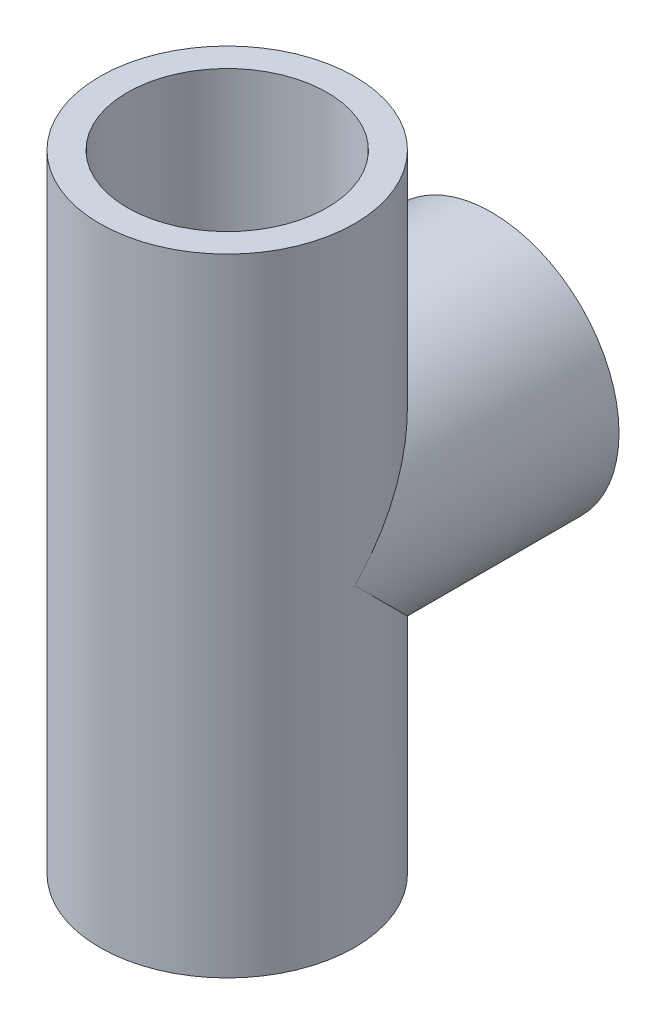
from build123d import *

# Parameters (mm, degrees)
SKETCH1_R           = 17.145
SKETCH1_R_2         = 11.43
BOSS_EXTRUDE1_DEPTH = 84.328
SKETCH2_R           = 17.145
SKETCH2_R_2         = 11.43
BOSS_EXTRUDE2_DEPTH = 35.56
SKETCH3_R           = 11.43
CUT_EXTRUDE1_DEPTH  = 94.111096186
CUT_EXTRUDE2_START  = -35.56
SKETCH4_R           = 11.43
CUT_EXTRUDE2_DEPTH  = 35.56
SKETCH5_R           = 13.4366
CUT_EXTRUDE3_DEPTH  = 20.6375
CUT_EXTRUDE4_START  = -20.6375
SKETCH6_R           = 13.4366
CUT_EXTRUDE4_DEPTH  = 20.6375
SKETCH7_R           = 13.4366
CUT_EXTRUDE5_DEPTH  = 20.6375


with BuildPart() as part:
    # Sketch1 → Boss-Extrude1 (new body)
    with BuildSketch(Plane(origin=(0, 0, 0), x_dir=(1, 0, 0), z_dir=(0, 1, 0))):
        with Locations(Location((0, 0, 0), (0, 0, 270))):
            Circle(SKETCH1_R)
        with Locations(Location((0, 0, 0), (0, 0, 270))):
            Circle(SKETCH1_R_2, mode=Mode.SUBTRACT)
    extrude(amount=BOSS_EXTRUDE1_DEPTH)

    # Sketch2 → Boss-Extrude2 (add)
    with BuildSketch(Plane.XY):
        with Locations((0, 42.164)):
            Circle(SKETCH2_R)
        with Locations((0, 42.164)):
            Circle(SKETCH2_R_2, mode=Mode.SUBTRACT)
    extrude(amount=-BOSS_EXTRUDE2_DEPTH)

    # Sketch3 → Cut-Extrude1 (cut, through all)
    with BuildSketch(Plane(origin=(0, 84.328, 0), x_dir=(1, 0, 0), z_dir=(0, 1, 0))):
        with Locations(Location((0, 0, 0), (0, 0, 270))):
            Circle(SKETCH3_R)
    extrude(amount=-CUT_EXTRUDE1_DEPTH, mode=Mode.SUBTRACT)

    # Sketch4 → Cut-Extrude2 (cut)
    with BuildSketch(Plane(origin=(0, 0, -35.56), x_dir=(-1, 0, 0), z_dir=(0, 0, -1)).offset(CUT_EXTRUDE2_START)):
        with Locations(Location((0, 42.164, 0), (0, 0, 180))):
            Circle(SKETCH4_R)
    extrude(amount=CUT_EXTRUDE2_DEPTH, mode=Mode.SUBTRACT)

    # Sketch5 → Cut-Extrude3 (cut)
    with BuildSketch(Plane(origin=(0, 84.328, 0), x_dir=(1, 0, 0), z_dir=(0, 1, 0))):
        with Locations(Location((0, 0, 0), (0, 0, 270))):
            Circle(SKETCH5_R)
    extrude(amount=-CUT_EXTRUDE3_DEPTH, mode=Mode.SUBTRACT)

    # Sketch6 → Cut-Extrude4 (cut)
    with BuildSketch(Plane.XZ.offset(CUT_EXTRUDE4_START)):
        with Locations(Location((0, 0, 0), (0, 0, 90))):
            Circle(SKETCH6_R)
    extrude(amount=CUT_EXTRUDE4_DEPTH, mode=Mode.SUBTRACT)

    # Sketch7 → Cut-Extrude5 (cut)
    with BuildSketch(Plane(origin=(0, 0, -35.56), x_dir=(-1, 0, 0), z_dir=(0, 0, -1))):
        with Locations((0, 42.164)):
            Circle(SKETCH7_R)
    extrude(amount=-CUT_EXTRUDE5_DEPTH, mode=Mode.SUBTRACT)


solid = part.part
